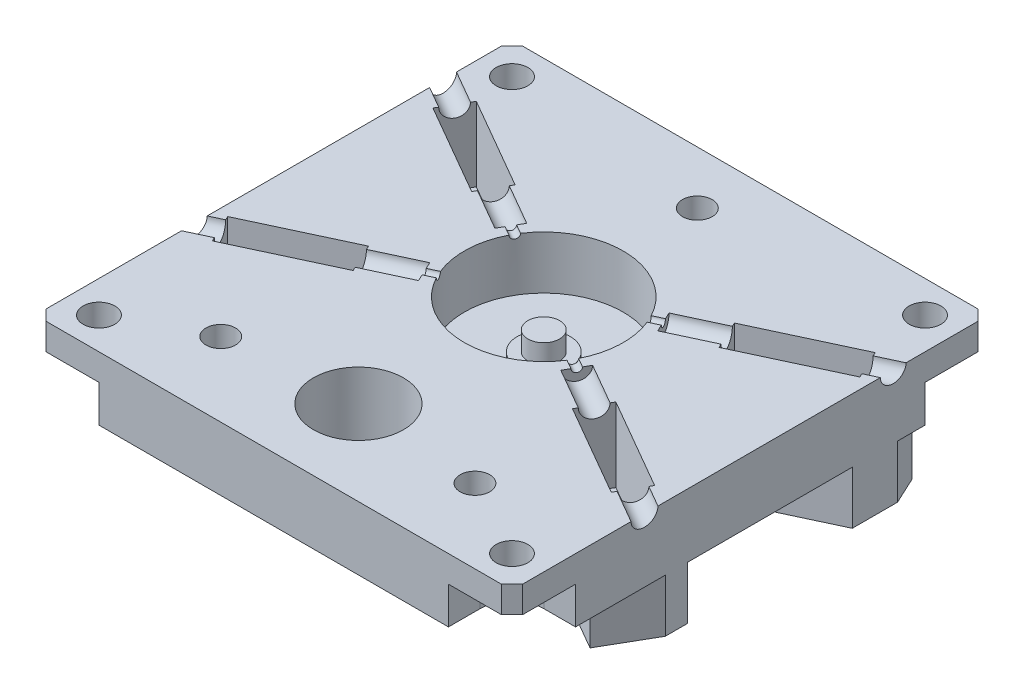
from build123d import *

# Parameters (mm, degrees)
SKETCH_1_W               = 45
SKETCH_1_H               = 45
EXTRUDE_1_DEPTH          = 6
SKETCH_2_R               = 7.5
CUT_EXTRUDE_1_DEPTH      = 4
CUT_EXTRUDE_START        = -4.5
SKETCH_4_R               = 1.1
CUT_EXTRUDE_2_DEPTH      = 52.400158435
SKETCH_5_R               = 0.4
CUT_EXTRUDE_3_DEPTH      = 2
SKETCH_6_R               = 1.1
CUT_EXTRUDE_4_DEPTH      = 52.103497325
SKETCH_7_R               = 0.4
CUT_EXTRUDE_5_DEPTH      = 2
CUT_EXTRUDE_6_DEPTH      = 33.380549717
SKETCH_16_R              = 1.1
EXTRUDE_4_DEPTH          = 5
SKETCH_17_R              = 1
CUT_EXTRUDE_12_DEPTH     = 10
SKETCH_18_R              = 1
CUT_EXTRUDE_13_DEPTH     = 10
PATTERN_CIRCULAR_1_COUNT = 2
SKETCH_10_R              = 4.25
CUT_EXTRUDE_7_DEPTH      = 34.538603786
SKETCH_9_R               = 1.5
CUT_EXTRUDE_8_DEPTH      = 34.538603786
SKETCH_12_R              = 7.5
CUT_EXTRUDE_10_DEPTH     = 1
SKETCH_13_R              = 2.5
EXTRUDE_2_DEPTH          = 0.5
SKETCH_14_R              = 1.5
EXTRUDE_3_DEPTH          = 1.8
CUT_EXTRUDE_11_DEPTH     = 3.5
CUT_EXTRUDE_15_DEPTH     = 1
CUT_EXTRUDE_14_DEPTH     = 34.538603786
SKETCH_21_R              = 1.4
CUT_EXTRUDE_16_DEPTH     = 34.667491772
CHAMFER_1_SIZE           = 1


with BuildPart() as part:
    # 草图1 → 凸台-拉伸1 (new body)
    with BuildSketch(Plane(origin=(0, 0, 0), x_dir=(1, 0, 0), z_dir=(0, 1, 0))):
        Rectangle(SKETCH_1_W, SKETCH_1_H)
    extrude(amount=EXTRUDE_1_DEPTH)

    # 草图2 → 切除-拉伸1 (cut)
    with BuildSketch(Plane(origin=(0, 6, 0), x_dir=(1, 0, 0), z_dir=(0, 1, 0))):
        with Locations((0, 3)):
            Circle(SKETCH_2_R)
    extrude(amount=-CUT_EXTRUDE_1_DEPTH, mode=Mode.SUBTRACT)

    # 草图4 → 切除-拉伸2 (cut)
    with BuildSketch(Plane(origin=(-11.258330249, 6, -9.5), x_dir=(-0.5000000000000039, 0, 0.8660254037844364), z_dir=(-0.8660254037844364, 0, -0.5000000000000039)).offset(CUT_EXTRUDE_START)):
        Circle(SKETCH_4_R)
    cut_extrude_2 = extrude(amount=CUT_EXTRUDE_2_DEPTH, mode=Mode.SUBTRACT)

    # 草图5 → 切除-拉伸3 (cut)
    with BuildSketch(Plane(origin=(-8.660254038, 0, -5), x_dir=(-0.5000000000000039, 0, 0.8660254037844365), z_dir=(-0.8660254037844365, 0, -0.5000000000000039))):
        with Locations((-2.598076211, 6)):
            Circle(SKETCH_5_R)
    cut_extrude_3 = extrude(amount=-CUT_EXTRUDE_3_DEPTH, mode=Mode.SUBTRACT)

    # 草图6 → 切除-拉伸4 (cut)
    with BuildSketch(Plane(origin=(11.782001231, 6, -8.494037403), x_dir=(-0.42261826174070416, 0, -0.9063077870366479), z_dir=(0.9063077870366479, 0, -0.42261826174070416)).offset(CUT_EXTRUDE_START)):
        Circle(SKETCH_6_R)
    cut_extrude_4 = extrude(amount=CUT_EXTRUDE_4_DEPTH, mode=Mode.SUBTRACT)

    # 草图7 → 切除-拉伸5 (cut)
    with BuildSketch(Plane(origin=(8.852682854, 0, -4.12807381), x_dir=(-0.42261826174070416, 0, -0.9063077870366479), z_dir=(0.9063077870366479, 0, -0.42261826174070416))):
        with Locations((2.718923361, 6)):
            Circle(SKETCH_7_R)
    cut_extrude_5 = extrude(amount=-CUT_EXTRUDE_5_DEPTH, mode=Mode.SUBTRACT)

    # 草图8 → 切除-拉伸6 (cut, through all)
    with BuildSketch(Plane(origin=(0, 6, 0), x_dir=(1, 0, 0), z_dir=(0, 1, 0))):
        Polygon((-10.508330249, 10.799038106), (-12.008330249, 8.200961894), (-20.668584287, 13.200961894), (-19.168584287, 15.799038106), align=None)
        Polygon((12.415928624, 7.134575722), (11.148073839, 9.853499083), (20.211151709, 14.079681701), (21.479006494, 11.360758339), align=None)
    cut_extrude_6 = extrude(amount=-CUT_EXTRUDE_6_DEPTH, mode=Mode.SUBTRACT)

    # 草图16 → 凸台-拉伸4 (add)
    # profile 1 of 2: a face of its own
    with BuildSketch(Plane.XZ):
        Polygon((21.17853076, -16.737533798), (8.490221741, -10.820878134), (11.448549573, -4.476723625), (24.136858592, -10.393379289), align=None)
        with Locations((19.032463528, -11.874983497)):
            Circle(SKETCH_16_R, mode=Mode.SUBTRACT)
    # profile 2 of 2: a face of its own
    with BuildSketch(Plane.XZ):
        Polygon((-19.900635095, -18.531088913), (-7.776279442, -11.531088913), (-11.276279442, -5.468911087), (-23.400635095, -12.468911087), align=None)
        with Locations((-18.186533479, -13.5)):
            Circle(SKETCH_16_R, mode=Mode.SUBTRACT)
    extrude_4 = extrude(amount=EXTRUDE_4_DEPTH)

    # 草图17 → 切除-拉伸12 (cut)
    with BuildSketch(Plane(origin=(11.118452322, 0, -5.184619465), x_dir=(0.42261826174070394, 0, 0.9063077870366479), z_dir=(-0.9063077870366479, 0, 0.42261826174070394))):
        with Locations((-2.718923361, -2.5)):
            Circle(SKETCH_17_R)
    cut_extrude_12 = extrude(amount=-CUT_EXTRUDE_12_DEPTH, mode=Mode.SUBTRACT)

    # 草图18 → 切除-拉伸13 (cut)
    with BuildSketch(Plane(origin=(-10.825317547, 0, -6.25), x_dir=(0.5000000000000002, 0, -0.8660254037844386), z_dir=(0.8660254037844385, 0, 0.5000000000000001))):
        with Locations((2.598076211, -2.5)):
            Circle(SKETCH_18_R)
    cut_extrude_13 = extrude(amount=-CUT_EXTRUDE_13_DEPTH, mode=Mode.SUBTRACT)

    # 阵列(圆周)1: 切除-拉伸2, 切除-拉伸3, 切除-拉伸4, 切除-拉伸5, 切除-拉伸6, 凸台-拉伸4, 切除-拉伸12, 切除-拉伸13 ×2 about axis
    pattern_circular_1_axis = Axis((0, 2, -3), (0, 1, 0))
    add([cut_extrude_2.rotate(pattern_circular_1_axis, i * 360 / PATTERN_CIRCULAR_1_COUNT) for i in range(1, PATTERN_CIRCULAR_1_COUNT)], mode=Mode.SUBTRACT)
    add([cut_extrude_3.rotate(pattern_circular_1_axis, i * 360 / PATTERN_CIRCULAR_1_COUNT) for i in range(1, PATTERN_CIRCULAR_1_COUNT)], mode=Mode.SUBTRACT)
    add([cut_extrude_4.rotate(pattern_circular_1_axis, i * 360 / PATTERN_CIRCULAR_1_COUNT) for i in range(1, PATTERN_CIRCULAR_1_COUNT)], mode=Mode.SUBTRACT)
    add([cut_extrude_5.rotate(pattern_circular_1_axis, i * 360 / PATTERN_CIRCULAR_1_COUNT) for i in range(1, PATTERN_CIRCULAR_1_COUNT)], mode=Mode.SUBTRACT)
    add([cut_extrude_6.rotate(pattern_circular_1_axis, i * 360 / PATTERN_CIRCULAR_1_COUNT) for i in range(1, PATTERN_CIRCULAR_1_COUNT)], mode=Mode.SUBTRACT)
    add([extrude_4.rotate(pattern_circular_1_axis, i * 360 / PATTERN_CIRCULAR_1_COUNT) for i in range(1, PATTERN_CIRCULAR_1_COUNT)])
    add([cut_extrude_12.rotate(pattern_circular_1_axis, i * 360 / PATTERN_CIRCULAR_1_COUNT) for i in range(1, PATTERN_CIRCULAR_1_COUNT)], mode=Mode.SUBTRACT)
    add([cut_extrude_13.rotate(pattern_circular_1_axis, i * 360 / PATTERN_CIRCULAR_1_COUNT) for i in range(1, PATTERN_CIRCULAR_1_COUNT)], mode=Mode.SUBTRACT)

    # 草图10 → 切除-拉伸7 (cut, through all)
    with BuildSketch(Plane.XZ):
        with Locations((0, 14.5)):
            Circle(SKETCH_10_R)
    extrude(amount=-CUT_EXTRUDE_7_DEPTH, mode=Mode.SUBTRACT)

    # 草图9 → 切除-拉伸8 (cut, through all)
    with BuildSketch(Plane.XZ):
        with Locations((-19.5, 19.5)):
            Circle(SKETCH_9_R)
        with Locations((19.5, 19.5)):
            Circle(SKETCH_9_R)
        with Locations((19.5, -19.5)):
            Circle(SKETCH_9_R)
        with Locations((-19.5, -19.5)):
            Circle(SKETCH_9_R)
    extrude(amount=-CUT_EXTRUDE_8_DEPTH, mode=Mode.SUBTRACT)

    # 草图12 → 切除-拉伸10 (cut)
    with BuildSketch(Plane(origin=(0, 2, 0), x_dir=(1, 0, 0), z_dir=(0, 1, 0))):
        with Locations((0, 3)):
            Circle(SKETCH_12_R)
    extrude(amount=-CUT_EXTRUDE_10_DEPTH, mode=Mode.SUBTRACT)

    # 草图13 → 凸台-拉伸2 (add)
    with BuildSketch(Plane(origin=(0, 1, 0), x_dir=(1, 0, 0), z_dir=(0, 1, 0))):
        with Locations((0, 3)):
            Circle(SKETCH_13_R)
    extrude(amount=EXTRUDE_2_DEPTH)

    # 草图14 → 凸台-拉伸3 (add)
    with BuildSketch(Plane(origin=(0, 1.5, 0), x_dir=(1, 0, 0), z_dir=(0, 1, 0))):
        with Locations((0, 3)):
            Circle(SKETCH_14_R)
    extrude(amount=EXTRUDE_3_DEPTH)

    # 草图15 → 切除-拉伸11 (cut)
    with BuildSketch(Plane.XZ):
        with BuildLine():
            Line((-16.5, 19.5), (-16.5, 22.5))
            Line((-16.5, 22.5), (-22.5, 22.5))
            Line((-22.5, 22.5), (-22.5, 16.5))
            Line((-22.5, 16.5), (-19.5, 16.5))
            ThreePointArc((-19.5, 16.5), (-17.378679656, 17.378679656), (-16.5, 19.5))
        make_face()
        with BuildLine():
            Line((16.5, 22.5), (22.5, 22.5))
            Line((22.5, 22.5), (22.5, 16.5))
            Line((22.5, 16.5), (19.5, 16.5))
            ThreePointArc((19.5, 16.5), (17.378679656, 17.378679656), (16.5, 19.5))
            Line((16.5, 19.5), (16.5, 22.5))
        make_face()
        with BuildLine():
            Line((16.5, -19.5), (16.5, -22.5))
            Line((16.5, -22.5), (22.5, -22.5))
            Line((22.5, -22.5), (22.5, -16.5))
            Line((22.5, -16.5), (19.5, -16.5))
            ThreePointArc((19.5, -16.5), (17.378679656, -17.378679656), (16.5, -19.5))
        make_face()
        with BuildLine():
            Line((-16.5, -22.5), (-22.5, -22.5))
            Line((-22.5, -22.5), (-22.5, -16.5))
            Line((-22.5, -16.5), (-19.5, -16.5))
            ThreePointArc((-19.5, -16.5), (-17.378679656, -17.378679656), (-16.5, -19.5))
            Line((-16.5, -19.5), (-16.5, -22.5))
        make_face()
    extrude(amount=-CUT_EXTRUDE_11_DEPTH, mode=Mode.SUBTRACT)

    # 草图20 → 切除-拉伸15 (cut)
    with BuildSketch(Plane(origin=(0, 0, 0), x_dir=(1, 0, 0), z_dir=(0, 1, 0))):
        Polygon((-12.008330249, 8.200961894), (-10.508330249, 10.799038106), (-19.168584287, 15.799038106), (-20.668584287, 13.200961894), align=None)
        Polygon((11.148073839, 9.853499083), (12.415928624, 7.134575722), (21.479006494, 11.360758339), (20.211151709, 14.079681701), align=None)
        Polygon((-21.479006494, -5.360758339), (-20.211151709, -8.079681701), (-11.148073839, -3.853499083), (-12.415928624, -1.134575722), align=None)
        Polygon((10.508330249, -4.799038106), (19.168584287, -9.799038106), (20.668584287, -7.200961894), (12.008330249, -2.200961894), align=None)
    extrude(amount=-CUT_EXTRUDE_15_DEPTH, mode=Mode.SUBTRACT)

    # 草图19 → 切除-拉伸14 (cut, through all)
    with BuildSketch(Plane(origin=(0, 0, 0), x_dir=(1, 0, 0), z_dir=(0, 1, 0))):
        Polygon((22.5, 13.903633867), (22.5, 9.630099592), (24.136858592, 10.393379289), align=None)
        Polygon((21.289294589, 16.5), (21.17853076, 16.737533798), (20.669137886, 16.5), align=None)
        with BuildLine():
            Line((-17.582558405, 17.192746713), (-19.900635095, 18.531088913))
            Line((-19.900635095, 18.531088913), (-21.073284825, 16.5))
            Line((-21.073284825, 16.5), (-19.5, 16.5))
            ThreePointArc((-19.5, 16.5), (-18.48062761, 16.678496867), (-17.582558405, 17.192746713))
        make_face()
        Polygon((-22.5, -7.903633867), (-22.5, -3.630099592), (-24.136858592, -4.393379289), align=None)
        Polygon((-22.5, 11.948929172), (-22.5, 14.02885683), (-23.400635095, 12.468911087), align=None)
        Polygon((23.400635095, -6.468911087), (22.5, -5.948929172), (22.5, -8.02885683), align=None)
    extrude(amount=-CUT_EXTRUDE_14_DEPTH, mode=Mode.SUBTRACT)

    # 草图21 → 切除-拉伸16 (cut, through all)
    with BuildSketch(Plane(origin=(0, 6, 0), x_dir=(1, 0, 0), z_dir=(0, 1, 0))):
        with Locations((0, 17.5)):
            Circle(SKETCH_21_R)
        with Locations((-12, -15.5)):
            Circle(SKETCH_21_R)
        with Locations((12, -15.5)):
            Circle(SKETCH_21_R)
    extrude(amount=-CUT_EXTRUDE_16_DEPTH, mode=Mode.SUBTRACT)

    # 倒角1
    chamfer_1_edges = [part.edges().sort_by_distance(p)[0] for p in [
        (-22.5, 4.75, 22.5),
        (22.5, 4.75, 22.5),
        (22.5, 4.75, -22.5),
        (-22.5, 4.75, -22.5),
    ]]
    chamfer(chamfer_1_edges, length=CHAMFER_1_SIZE)


solid = part.part
